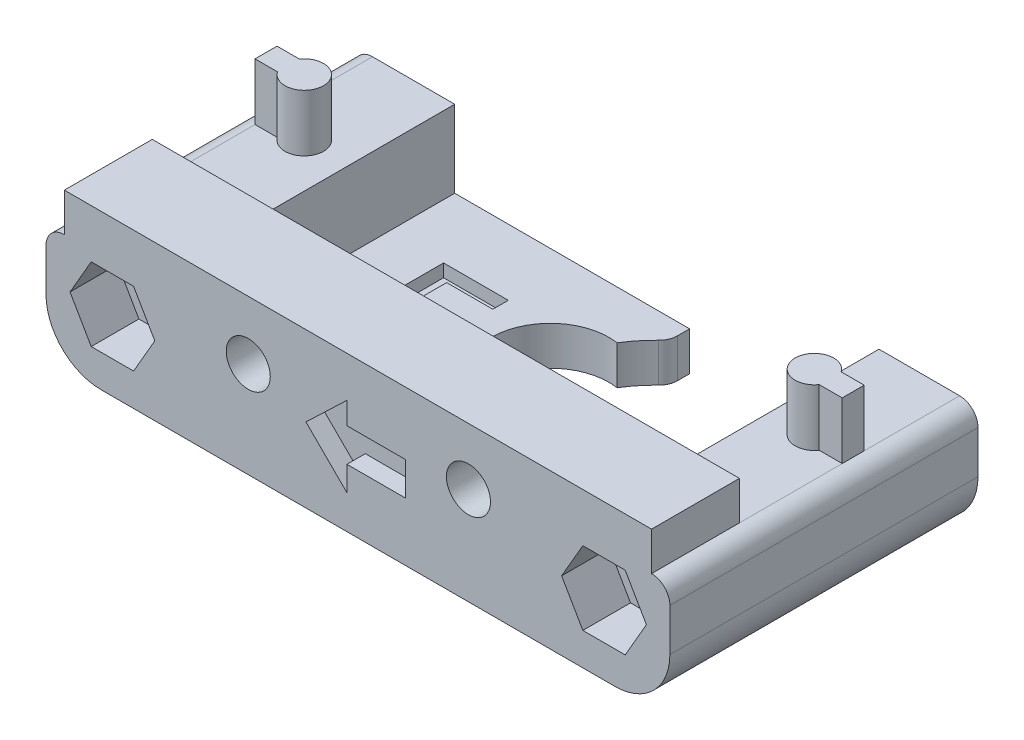
from build123d import *

# Parameters (mm, degrees)
EXTRUDE_1_DEPTH     = 2.121152063
SKETCH_2_W          = 18.284159781
SKETCH_2_H          = 2.121152063
EXTRUDE_2_DEPTH     = 1.283615947
SKETCH_3_W          = 7.715840219
SKETCH_3_H          = 2.121152063
EXTRUDE_3_DEPTH     = 1.283615947
EXTRUDE_4_DEPTH     = 4.2
SKETCH_5_W          = 31.999368794
SKETCH_5_H          = 4.790748137
EXTRUDE_5_DEPTH     = 2.1
SKETCH_6_W          = 12.000251863
SKETCH_6_H          = 4.2
CUT_EXTRUDE_1_DEPTH = 2.32
CUT_EXTRUDE_2_DEPTH = 23.550749058
EXTRUDE_6_DEPTH     = 3.1
EXTRUDE_7_DEPTH     = 3.1
CUT_EXTRUDE_3_DEPTH = 1
CUT_EXTRUDE_4_DEPTH = 2.6
CUT_EXTRUDE_5_DEPTH = 2.6
CUT_EXTRUDE_6_DEPTH = 0.7
CUT_EXTRUDE_7_DEPTH = 3.090748137
CUT_EXTRUDE_8_DEPTH = 3.090748137
HOLE_WIZARD_1_D     = 2.4
HOLE_WIZARD_1_DEPTH = 16.79105
HOLE_WIZARD_2_D     = 2.4
HOLE_WIZARD_2_DEPTH = 16.79105
HOLE_WIZARD_3_D     = 2.4
HOLE_WIZARD_3_DEPTH = 16.79105
HOLE_WIZARD_4_D     = 2.4
HOLE_WIZARD_4_DEPTH = 16.79105
FILLET_1_R          = 1
FILLET_2_R          = 1
FILLET_3_R          = 1
FILLET_4_R          = 1
FILLET_5_R          = 3
FILLET_6_R          = 3


with BuildPart() as part:
    # ｽｹｯﾁ1 → ﾎﾞｽ - 押し出し1 (new body)
    with BuildSketch(Plane.XZ.offset(24)):
        with BuildLine():
            Line((-17, 4.6), (-17, -10.907384053))
            Line((-17, -10.907384053), (1.284159781, -10.907384053))
            Line((1.284159781, -10.907384053), (1.284159781, -9.036499448))
            ThreePointArc((1.284159781, -9.036499448), (-3.636777298, -7.097679354), (-0.031629692, -3.227594621))
            ThreePointArc((-0.031629692, -3.227594621), (9.064370854, -1.683948584), (9.284159781, -10.907384053))
            Line((9.284159781, -10.907384053), (17, -10.907384053))
            Line((17, -10.907384053), (17, 4.6))
            Line((17, 4.6), (-17, 4.6))
        make_face()
    extrude(amount=-EXTRUDE_1_DEPTH)

    # ｽｹｯﾁ2 → ﾎﾞｽ - 押し出し2 (add)
    with BuildSketch(Plane(origin=(0, 0, -10.907384053), x_dir=(-1, 0, 0), z_dir=(0, 0, -1))):
        with Locations((7.85792011, -22.939423969)):
            Rectangle(SKETCH_2_W, SKETCH_2_H)
    extrude(amount=EXTRUDE_2_DEPTH)

    # ｽｹｯﾁ3 → ﾎﾞｽ - 押し出し3 (add)
    with BuildSketch(Plane(origin=(0, 0, -10.907384053), x_dir=(-1, 0, 0), z_dir=(0, 0, -1))):
        with Locations((-13.14207989, -22.939423969)):
            Rectangle(SKETCH_3_W, SKETCH_3_H)
    extrude(amount=EXTRUDE_3_DEPTH)

    # ｽｹｯﾁ4 → ﾎﾞｽ - 押し出し4 (add)
    with BuildSketch(Plane(origin=(0, -21.878847937, 0), x_dir=(-1, 0, 0), z_dir=(0, 1, 0))):
        with BuildLine():
            Line((17, 4.6), (17, -12.191))
            Line((17, -12.191), (11.515840219, -12.191))
            Line((11.515840219, -12.191), (11.515840219, -0.190748137))
            Line((11.515840219, -0.190748137), (-9.284159781, -0.190748137))
            Line((-9.284159781, -0.190748137), (-9.284159781, -12.191))
            add(Edge.make_bspline(
                [(-9.284159781, -12.191), (-10.057493115, -12.191), (-10.830826448, -12.191), (-11.604159781, -12.191)],
                knots=[0, 0, 0, 0, 1, 1, 1, 1], degree=3))
            Line((-11.604159781, -12.191), (-17, -12.191))
            Line((-17, -12.191), (-17, 4.6))
            Line((-17, 4.6), (17, 4.6))
        make_face()
    extrude(amount=EXTRUDE_4_DEPTH)

    # ｽｹｯﾁ5 → ﾎﾞｽ - 押し出し5 (add)
    with BuildSketch(Plane(origin=(0, -17.678847937, 0), x_dir=(-1, 0, 0), z_dir=(0, 1, 0))):
        with Locations((-0.000159781, 2.204625932)):
            Rectangle(SKETCH_5_W, SKETCH_5_H)
    extrude(amount=EXTRUDE_5_DEPTH)

    # ｽｹｯﾁ6 → ｶｯﾄ - 押し出し1 (cut)
    with BuildSketch(Plane.ZY.offset(-9.284159781)):
        with Locations((-6.190874069, -19.778847937)):
            Rectangle(SKETCH_6_W, SKETCH_6_H)
    extrude(amount=-CUT_EXTRUDE_1_DEPTH, mode=Mode.SUBTRACT)

    # ｽｹｯﾁ7 → ｶｯﾄ - 押し出し2 (cut, through all)
    with BuildSketch(Plane.XZ.offset(24)):
        with BuildLine():
            Line((1.284159781, -11.081163897), (1.284159781, -9.036499448))
            ThreePointArc((1.284159781, -9.036499448), (0.655198078, -9.368779249), (-0.031629692, -9.553901653))
            ThreePointArc((-0.031629692, -9.553901653), (0.562738255, -10.37226331), (1.284159781, -11.081163897))
        make_face()
    extrude(amount=-CUT_EXTRUDE_2_DEPTH, mode=Mode.SUBTRACT)

    # ｽｹｯﾁ8 → ﾎﾞｽ - 押し出し6 (add)
    with BuildSketch(Plane(origin=(0, -17.678847937, 0), x_dir=(-1, 0, 0), z_dir=(0, 1, 0))):
        with BuildLine():
            Line((15.999524616, -6.990748137), (14.777524616, -6.990748137))
            ThreePointArc((14.777524616, -6.990748137), (12.865840219, -6.390748137), (14.777524616, -5.790748137))
            Line((14.777524616, -5.790748137), (15.999524616, -5.790748137))
            Line((15.999524616, -5.790748137), (15.999524616, -6.990748137))
        make_face()
    extrude(amount=EXTRUDE_6_DEPTH)

    # ｽｹｯﾁ9 → ﾎﾞｽ - 押し出し7 (add)
    with BuildSketch(Plane(origin=(0, -17.678847937, 0), x_dir=(-1, 0, 0), z_dir=(0, 1, 0))):
        with BuildLine():
            Line((-15.999844178, -5.790748137), (-14.745844178, -5.790748137))
            ThreePointArc((-14.745844178, -5.790748137), (-12.834159781, -6.390748137), (-14.745844178, -6.990748137))
            Line((-14.745844178, -6.990748137), (-15.999844178, -6.990748137))
            Line((-15.999844178, -6.990748137), (-15.999844178, -5.790748137))
        make_face()
    extrude(amount=EXTRUDE_7_DEPTH)

    # ｽｹｯﾁ10 → ｶｯﾄ - 押し出し3 (cut)
    with BuildSketch(Plane.XY.offset(4.6)):
        Polygon((-0.599999987, -17.799999602), (-2.834665696, -19.9353347), (-0.599999987, -22.159852817), (-0.599999987, -20.818248187), (2.589334329, -20.818248187), (2.589334329, -18.999999575), (-0.599999987, -18.999999575), align=None)
    extrude(amount=-CUT_EXTRUDE_3_DEPTH, mode=Mode.SUBTRACT)

    # ｽｹｯﾁ11 → ｶｯﾄ - 押し出し4 (cut)
    with BuildSketch(Plane.XY.offset(4.6)):
        Polygon((-14.535820787, -22.230633649), (-12.22641971, -22.230633649), (-11.071719172, -20.230633649), (-12.22641971, -18.230633649), (-14.535820787, -18.230633649), (-15.690521325, -20.230633649), align=None)
    extrude(amount=-CUT_EXTRUDE_4_DEPTH, mode=Mode.SUBTRACT)

    # ｽｹｯﾁ12 → ｶｯﾄ - 押し出し5 (cut)
    with BuildSketch(Plane.XY.offset(4.6)):
        Polygon((12.255035689, -22.231967066), (14.564436765, -22.231967066), (15.719137304, -20.231967066), (14.564436765, -18.231967066), (12.255035689, -18.231967066), (11.10033515, -20.231967066), align=None)
    extrude(amount=-CUT_EXTRUDE_5_DEPTH, mode=Mode.SUBTRACT)

    # ｽｹｯﾁ13 → ｶｯﾄ - 押し出し6 (cut)
    with BuildSketch(Plane(origin=(0, -21.878847937, 0), x_dir=(-1, 0, 0), z_dir=(0, 1, 0))):
        Polygon((7.518980495, -7.752475082), (5.003355584, -7.752475082), (5.003355584, -8.596713483), (8.530699304, -8.596713483), (8.530699304, -3.62698698), (7.518980495, -3.62698698), align=None)
    extrude(amount=-CUT_EXTRUDE_6_DEPTH, mode=Mode.SUBTRACT)

    # ｽｹｯﾁ14 → ｶｯﾄ - 押し出し7 (cut)
    with BuildSketch(Plane(origin=(0, 0, -0.190748137), x_dir=(-1, 0, 0), z_dir=(0, 0, -1))):
        Polygon((-7.185754105, -20.683997984), (-4.876353029, -20.683997984), (-3.72165249, -18.683997984), (-4.876353029, -16.683997984), (-7.185754105, -16.683997984), (-8.340454644, -18.683997984), align=None)
    extrude(amount=-CUT_EXTRUDE_7_DEPTH, mode=Mode.SUBTRACT)

    # ｽｹｯﾁ15 → ｶｯﾄ - 押し出し8 (cut)
    with BuildSketch(Plane(origin=(0, 0, -0.190748137), x_dir=(-1, 0, 0), z_dir=(0, 0, -1))):
        Polygon((4.835886318, -20.763995351), (7.145287395, -20.763995351), (8.299987933, -18.763995351), (7.145287395, -16.763995351), (4.835886318, -16.763995351), (3.68118578, -18.763995351), align=None)
    extrude(amount=-CUT_EXTRUDE_8_DEPTH, mode=Mode.SUBTRACT)

    # 穴1
    with Locations(Plane.XY.offset(4.6)):
        with Locations((-5.97769389, -18.770751676)):
            Hole(HOLE_WIZARD_1_D / 2, depth=HOLE_WIZARD_1_DEPTH)

    # 穴2
    with Locations(Plane.XY.offset(4.6)):
        with Locations((6.022013453, -18.686944197)):
            Hole(HOLE_WIZARD_2_D / 2, depth=HOLE_WIZARD_2_DEPTH)

    # 穴3
    with Locations(Plane(origin=(0, 0, -12.191), x_dir=(-1, 0, 0), z_dir=(0, 0, -1))):
        with Locations((-13.4, -20.25)):
            Hole(HOLE_WIZARD_3_D / 2, depth=HOLE_WIZARD_3_DEPTH)

    # 穴4
    with Locations(Plane(origin=(0, 0, -12.191), x_dir=(-1, 0, 0), z_dir=(0, 0, -1))):
        with Locations((13.4, -20.25)):
            Hole(HOLE_WIZARD_4_D / 2, depth=HOLE_WIZARD_4_DEPTH)

    # ﾌｨﾚｯﾄ1
    fillet_1_edges = [part.edges().sort_by_distance(p)[0] for p in [
        (9.284159781, -22.939423968, -10.907384053),
    ]]
    fillet(fillet_1_edges, radius=FILLET_1_R)

    # ﾌｨﾚｯﾄ2
    fillet_2_edges = [part.edges().sort_by_distance(p)[0] for p in [
        (1.284159781, -22.939423968, -11.081163897),
    ]]
    fillet(fillet_2_edges, radius=FILLET_2_R)

    # ﾌｨﾚｯﾄ3
    fillet_3_edges = [part.edges().sort_by_distance(p)[0] for p in [
        (-17, -17.678847937, -3.7955),
    ]]
    fillet(fillet_3_edges, radius=FILLET_3_R)

    # ﾌｨﾚｯﾄ4
    fillet_4_edges = [part.edges().sort_by_distance(p)[0] for p in [
        (17, -17.678847937, -3.7955),
    ]]
    fillet(fillet_4_edges, radius=FILLET_4_R)

    # ﾌｨﾚｯﾄ5
    fillet_5_edges = [part.edges().sort_by_distance(p)[0] for p in [
        (-17, -24, -3.7955),
    ]]
    fillet(fillet_5_edges, radius=FILLET_5_R)

    # ﾌｨﾚｯﾄ6
    fillet_6_edges = [part.edges().sort_by_distance(p)[0] for p in [
        (17, -24, -3.7955),
    ]]
    fillet(fillet_6_edges, radius=FILLET_6_R)


solid = part.part
